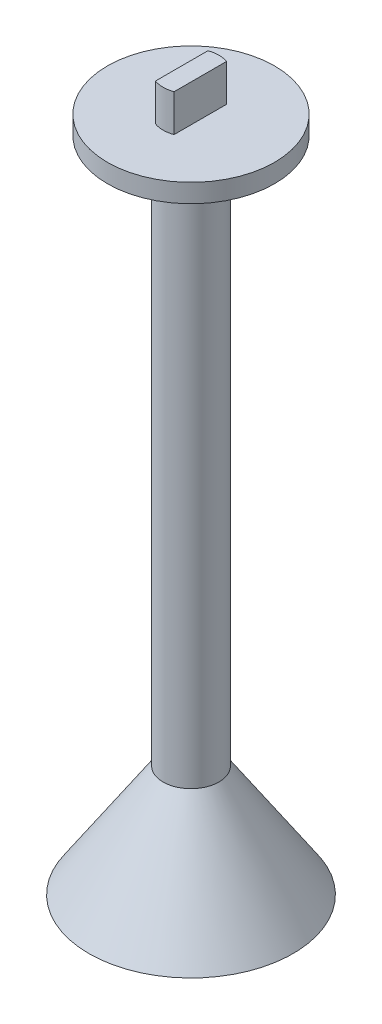
from build123d import *

# Parameters (mm, degrees)
SKETCH2_R           = 7.5
SKETCH1_R           = 27.5
SKETCH2_2_R         = 7.5
BOSS_EXTRUDE1_DEPTH = 162
SKETCH3_R           = 22.5
BOSS_EXTRUDE2_DEPTH = 5
CUT_EXTRUDE3_START  = -10
CUT_EXTRUDE3_DEPTH  = 10
SKETCH21_R          = 5
CUT_EXTRUDE4_DEPTH  = 20


with BuildPart() as part:
    # Sketch2 → Loft1 section 0
    with BuildSketch(Plane(origin=(0, 30, 0), x_dir=(1, 0, 0), z_dir=(0, 1, 0))):
        Circle(SKETCH2_R)
    # Sketch1 → Loft1 section 1
    with BuildSketch(Plane(origin=(0, 0, 0), x_dir=(1, 0, 0), z_dir=(0, 1, 0))):
        Circle(SKETCH1_R)
    loft()

    # Sketch2<2> → Boss-Extrude1 (add)
    with BuildSketch(Plane(origin=(0, 30, 0), x_dir=(1, 0, 0), z_dir=(0, 1, 0))):
        with Locations(Location((0, 0, 0), (0, 0, 90))):
            Circle(SKETCH2_2_R)
    extrude(amount=BOSS_EXTRUDE1_DEPTH)

    # Sketch3 → Boss-Extrude2 (add)
    with BuildSketch(Plane(origin=(0, 177, 0), x_dir=(1, 0, 0), z_dir=(0, 1, 0))):
        with Locations(Location((0, 0, 0), (0, 0, 270))):
            Circle(SKETCH3_R)
    extrude(amount=BOSS_EXTRUDE2_DEPTH)

    # Sketch5 → Cut-Extrude3 (cut)
    with BuildSketch(Plane(origin=(0, 192, 0), x_dir=(1, 0, 0), z_dir=(0, 1, 0)).offset(CUT_EXTRUDE3_START)):
        with BuildLine():
            ThreePointArc((7.5, 0), (6.123724357, 4.330127019), (2.5, 7.071067812))
            Line((2.5, 7.071067812), (2.5, -7.071067812))
            ThreePointArc((2.5, -7.071067812), (6.123724357, -4.330127019), (7.5, 0))
        make_face()
        with BuildLine():
            Line((-2.5, -7.071067812), (-2.5, 7.071067812))
            ThreePointArc((-2.5, 7.071067812), (-7.5, 0), (-2.5, -7.071067812))
        make_face()
    extrude(amount=CUT_EXTRUDE3_DEPTH, mode=Mode.SUBTRACT)

    # Sketch21 → Cut-Extrude4 (cut)
    with BuildSketch(Plane.XZ):
        with Locations(Location((0, 0, 0), (0, 0, 270))):
            Circle(SKETCH21_R)
    extrude(amount=-CUT_EXTRUDE4_DEPTH, mode=Mode.SUBTRACT)


solid = part.part
